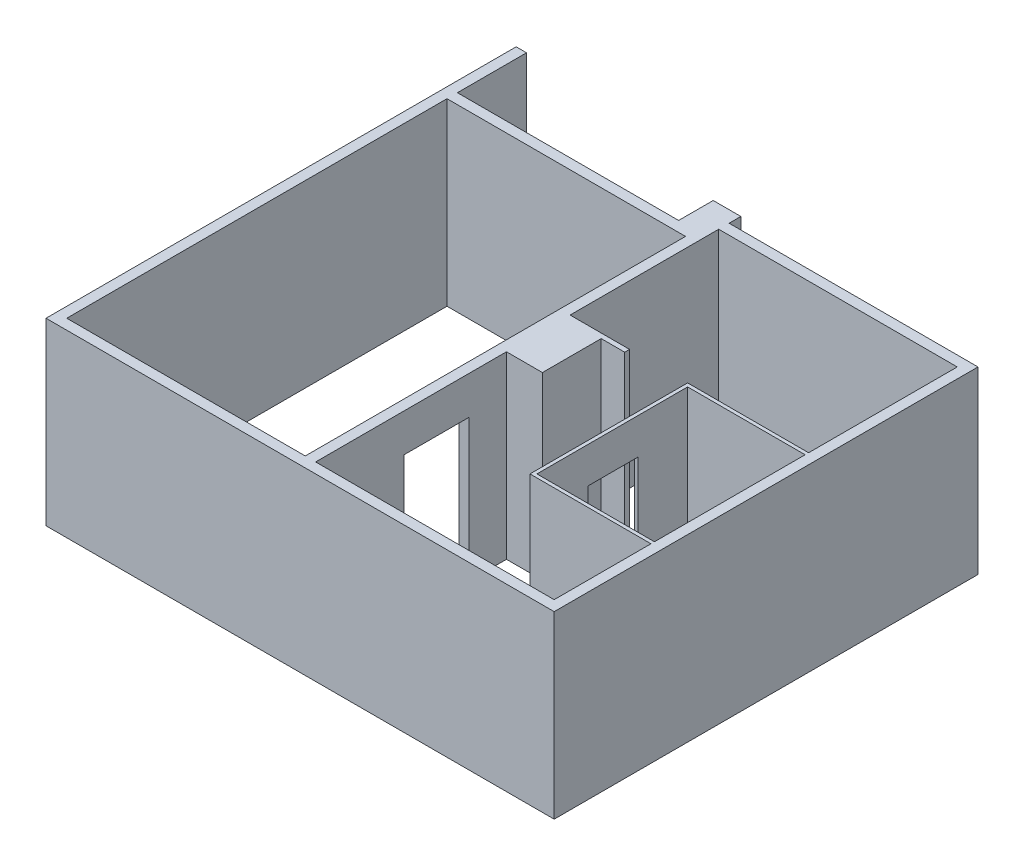
from build123d import *

# Parameters (mm, degrees)
SKETCH_1_W         = 3450
SKETCH_1_H         = 5500
SKETCH_1_W_2       = 1700
SKETCH_1_H_2       = 2180
EXTRUDE_1_DEPTH    = 2600
SKETCH1_W          = 940
SKETCH1_H          = 2050
CUT_EXTRUDE1_DEPTH = 150
SKETCH2_W          = 720
SKETCH2_H          = 1950
CUT_EXTRUDE2_DEPTH = 50


with BuildPart() as part:
    # Эскиз1 → Бобышка-Вытянуть1 (new body)
    with BuildSketch(Plane(origin=(0, 0, 0), x_dir=(1, 0, 0), z_dir=(0, 1, 0))):
        Polygon((-3600, 2970), (-3600, 839.388268919), (-3600, -3830), (3750, -3830), (3750, 2300), (150, 2300), (150, 2470), (-250, 2470), (-250, 1970), (-3450, 1970), (-3450, 2970), align=None)
        with Locations((-1725, -930)):
            Rectangle(SKETCH_1_W, SKETCH_1_H, mode=Mode.SUBTRACT)
        Polygon((150, 2150), (150, 0), (1010, 0), (1010, -70), (670, -70), (670, -920), (150, -920), (150, -3680), (3600, -3680), (3600, -2280), (1850, -2280), (1850, 0), (3600, 0), (3600, 2150), align=None, mode=Mode.SUBTRACT)
        with Locations((2750, -1140)):
            Rectangle(SKETCH_1_W_2, SKETCH_1_H_2, mode=Mode.SUBTRACT)
    extrude(amount=EXTRUDE_1_DEPTH)

    # Sketch1 → Cut-Extrude1 (cut)
    with BuildSketch(Plane.ZY):
        with Locations((1930, 1025)):
            Rectangle(SKETCH1_W, SKETCH1_H)
    extrude(amount=-CUT_EXTRUDE1_DEPTH, mode=Mode.SUBTRACT)

    # Sketch2 → Cut-Extrude2 (cut)
    with BuildSketch(Plane.ZY.offset(-1850)):
        with Locations((1130, 1105)):
            Rectangle(SKETCH2_W, SKETCH2_H)
    extrude(amount=-CUT_EXTRUDE2_DEPTH, mode=Mode.SUBTRACT)


solid = part.part
